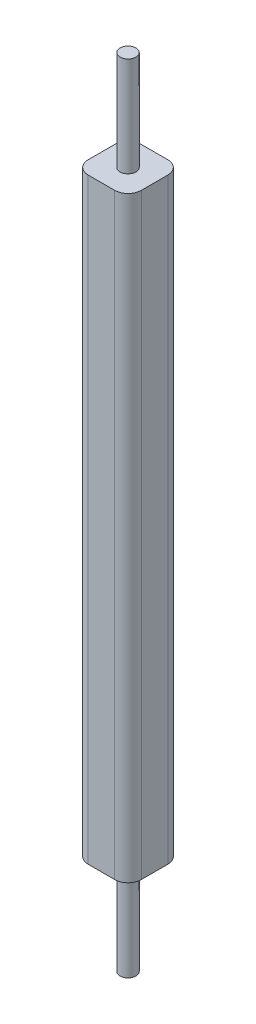
from build123d import *

# Parameters (mm, degrees)
SKETCH_1_R      = 6
EXTRUDE_1_DEPTH = 300
SKETCH_2_W      = 40
SKETCH_2_H      = 40
EXTRUDE_2_DEPTH = 225
FILLET_1_R      = 10


with BuildPart() as part:
    # 草图1 → 凸台-拉伸1 (new, symmetric)
    with BuildSketch(Plane(origin=(0, 0, 0), x_dir=(1, 0, 0), z_dir=(0, 1, 0))):
        with Locations(Location((0, 0, 0), (0, 0, 270))):
            Circle(SKETCH_1_R)
    extrude(amount=EXTRUDE_1_DEPTH, both=True)

    # 草图2 → 凸台-拉伸2 (add, symmetric)
    with BuildSketch(Plane(origin=(0, 0, 0), x_dir=(1, 0, 0), z_dir=(0, 1, 0))):
        Rectangle(SKETCH_2_W, SKETCH_2_H)
    extrude(amount=EXTRUDE_2_DEPTH, both=True)

    # 圆角1
    fillet_1_edges = [part.edges().sort_by_distance(p)[0] for p in [
        (20, 0, 20),
        (20, 0, -20),
        (-20, 0, -20),
        (-20, 0, 20),
    ]]
    fillet(fillet_1_edges, radius=FILLET_1_R)


solid = part.part
